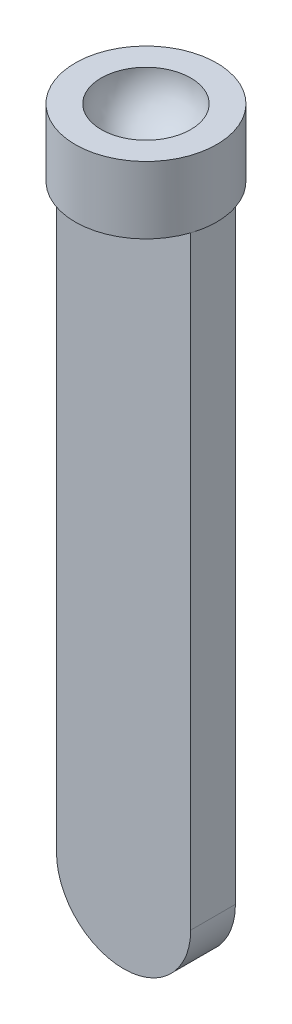
from build123d import *

# Parameters (mm, degrees)
BOSS_EXTRUDE1_DEPTH = 5
SKETCH4_R           = 15.811388301
BOSS_EXTRUDE2_DEPTH = 15


with BuildPart() as part:
    # Sketch1 → Boss-Extrude1 (new, symmetric)
    with BuildSketch(Plane.XY):
        with BuildLine():
            Line((-15, -75), (-15, 75))
            Line((-15, 75), (15, 75))
            Line((15, 75), (15, -75))
            ThreePointArc((15, -75), (0, -90), (-15, -75))
        make_face()
    extrude(amount=BOSS_EXTRUDE1_DEPTH, both=True)

    # Sketch4 → Boss-Extrude2 (add)
    with BuildSketch(Plane(origin=(0, 75, 0), x_dir=(1, 0, 0), z_dir=(0, 1, 0))):
        with Locations(Location((0, 0, 0), (0, 0, 270))):
            Circle(SKETCH4_R)
    extrude(amount=-BOSS_EXTRUDE2_DEPTH)

    # Sketch6 → Cut-Revolve3 (revolve, cut)
    with BuildSketch(Plane.XY):
        with BuildLine():
            Line((0, 75), (10, 75))
            ThreePointArc((10, 75), (7.071067812, 67.928932188), (0, 65))
            Line((0, 65), (0, 75))
        make_face()
    revolve(axis=Axis((0, 75, 0), (0, -1, 0)), mode=Mode.SUBTRACT)


solid = part.part
